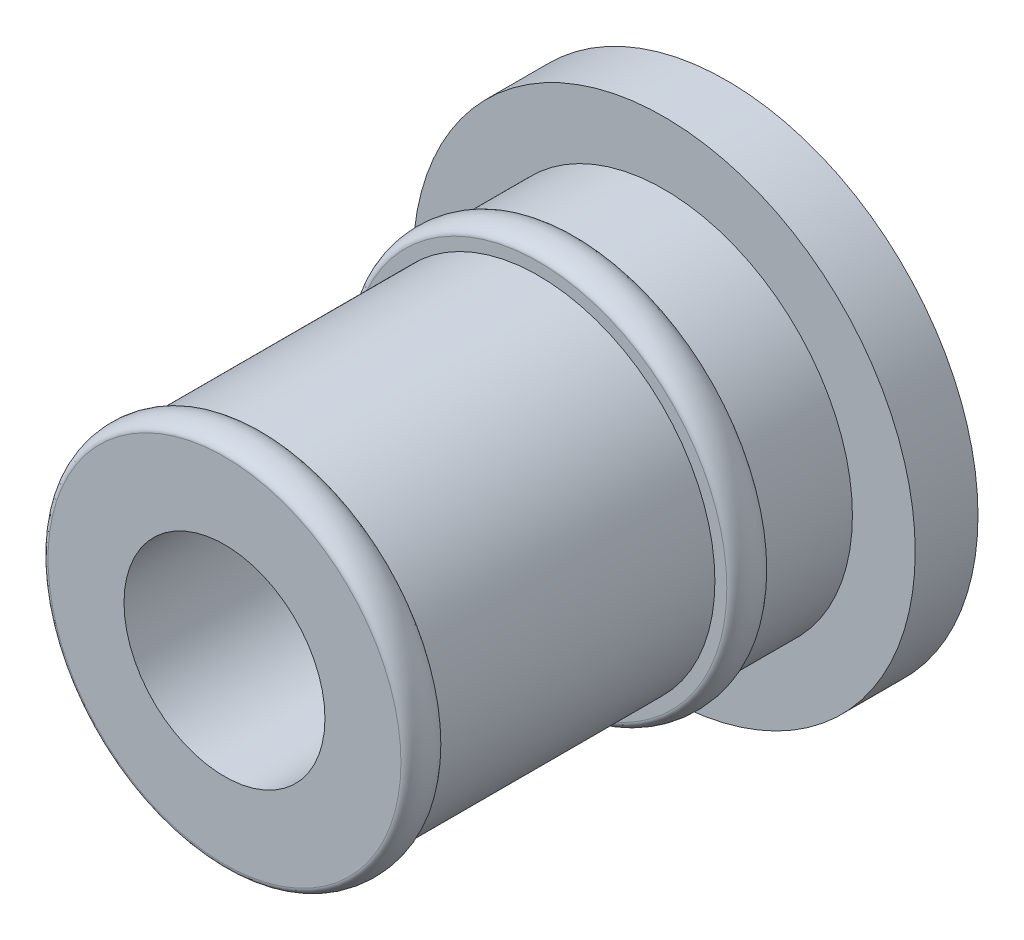
from build123d import *

# Parameters (mm, degrees)
SKETCH1_R           = 4
SKETCH1_R_2         = 1.6
BOSS_EXTRUDE1_DEPTH = 8


with BuildPart() as part:
    # Sketch1 → Boss-Extrude1 (new body)
    with BuildSketch(Plane.XY):
        Circle(SKETCH1_R)
        Circle(SKETCH1_R_2, mode=Mode.SUBTRACT)
    extrude(amount=BOSS_EXTRUDE1_DEPTH)

    # Sketch2 → Cut-Revolve1 (revolve, cut)
    with BuildSketch(Plane(origin=(0, 0, 0), x_dir=(0, 0, -1), z_dir=(1, 0, 0)), mode=Mode.PRIVATE) as cut_revolve1_sk:
        with BuildLine():
            Line((-2.4, 3), (-1, 3))
            Line((-1, 3), (-1, 4))
            Line((-1, 4), (-8, 4))
            Line((-8, 4), (-8, 2.81))
            add(Edge.make_bspline(
                [(-7.4, 2.81), (-7.4, 2.96), (-7.7, 2.96), (-8, 2.96), (-8, 2.81)],
                knots=[0, 0, 0, 1.570796327, 1.570796327, 3.141592654, 3.141592654, 3.141592654], degree=2, weights=[1, 0.707106781, 1, 0.707106781, 1]))
            Line((-7.4, 2.81), (-3, 2.81))
            Line((-3, 2.81), (-3, 3))
            add(Edge.make_bspline(
                [(-2.4, 3), (-2.4, 3.15), (-2.7, 3.15), (-3, 3.15), (-3, 3)],
                knots=[0, 0, 0, 1.570796327, 1.570796327, 3.141592654, 3.141592654, 3.141592654], degree=2, weights=[1, 0.707106781, 1, 0.707106781, 1]))
        make_face()
    revolve(cut_revolve1_sk.sketch.rotate(Axis((0, 0, 8), (0, 0, -1)), 90), axis=Axis((0, 0, 8), (0, 0, -1)), mode=Mode.SUBTRACT)


solid = part.part
